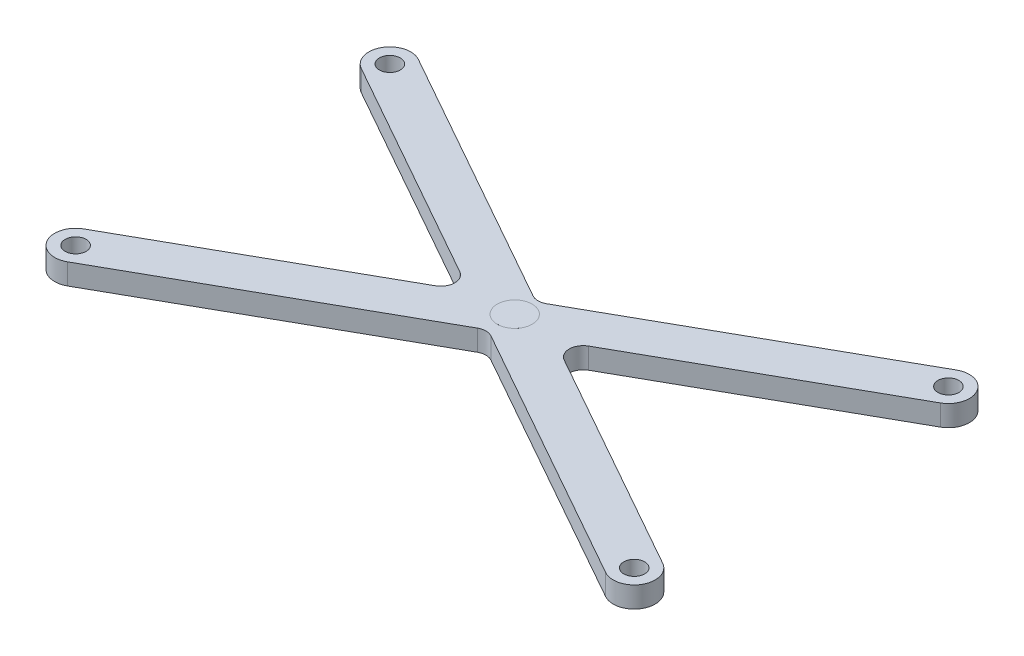
from build123d import *

# Parameters (mm, degrees)
SKETCH1_R           = 1.5
BOSS_EXTRUDE1_DEPTH = 3
SKETCH2_R           = 2.5
BOSS_EXTRUDE2_DEPTH = 0.001


with BuildPart() as part:
    # Sketch1 → Boss-Extrude1 (new body)
    with BuildSketch(Plane(origin=(0, 0, 0), x_dir=(1, 0, 0), z_dir=(0, 1, 0))):
        with BuildLine():
            Line((1.470120334, 47.615099655), (39.019477518, 26.493586162))
            ThreePointArc((39.019477518, 26.493586162), (40, 26.236737235), (40.980522482, 26.493586162))
            Line((40.980522482, 26.493586162), (78.529879666, 47.615099655))
            ThreePointArc((78.529879666, 47.615099655), (82.614620243, 46.470972803), (81.471825115, 42.385859447))
            Line((81.471825115, 42.385859447), (49.218121455, 24.243151073))
            ThreePointArc((49.218121455, 24.243151073), (48.198643937, 22.5), (49.218121455, 20.756848927))
            Line((49.218121455, 20.756848927), (81.471825115, 2.614140553))
            ThreePointArc((81.471825115, 2.614140553), (82.614620243, -1.470972803), (78.529879666, -2.615099655))
            Line((78.529879666, -2.615099655), (40.980522482, 18.506413838))
            ThreePointArc((40.980522482, 18.506413838), (40, 18.763262765), (39.019477518, 18.506413838))
            Line((39.019477518, 18.506413838), (1.470120334, -2.615099655))
            ThreePointArc((1.470120334, -2.615099655), (-2.614620243, -1.470972803), (-1.471825115, 2.614140553))
            Line((-1.471825115, 2.614140553), (30.781878545, 20.756848927))
            ThreePointArc((30.781878545, 20.756848927), (31.801356063, 22.5), (30.781878545, 24.243151073))
            Line((30.781878545, 24.243151073), (-1.471825115, 42.385859447))
            ThreePointArc((-1.471825115, 42.385859447), (-2.614620243, 46.470972803), (1.470120334, 47.615099655))
        make_face()
        with Locations(Location((0, 45, 0), (0, 0, 270))):
            Circle(SKETCH1_R, mode=Mode.SUBTRACT)
        with Locations(Location((80, 45, 0), (0, 0, 270))):
            Circle(SKETCH1_R, mode=Mode.SUBTRACT)
        with Locations(Location((80, 0, 0), (0, 0, 270))):
            Circle(SKETCH1_R, mode=Mode.SUBTRACT)
        with Locations(Location((0, 0, 0), (0, 0, 270))):
            Circle(SKETCH1_R, mode=Mode.SUBTRACT)
    extrude(amount=BOSS_EXTRUDE1_DEPTH)

    # Sketch2 → Boss-Extrude2 (add)
    with BuildSketch(Plane(origin=(0, 3, 0), x_dir=(1, 0, 0), z_dir=(0, 1, 0))):
        with Locations(Location((39.97951418, 22.909712694, 0), (0, 0, 270))):
            Circle(SKETCH2_R)
    extrude(amount=BOSS_EXTRUDE2_DEPTH)


solid = part.part
